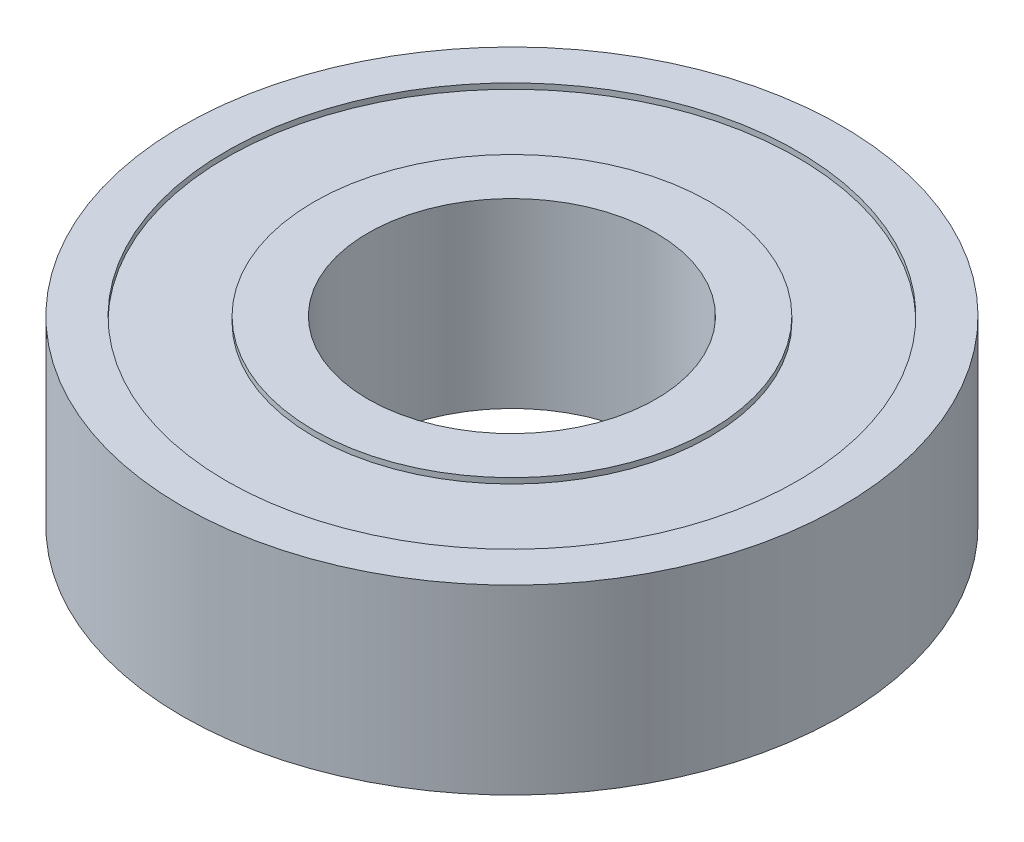
from build123d import *

# Parameters (mm, degrees)
ESBO_O1_R                = 14.32
RESSALTO_EXTRUS_O1_DEPTH = 7.9
ESBO_O2_R                = 6.255
CORTE_EXTRUS_O1_DEPTH    = 7.9
ESBO_O3_R                = 12.41
ESBO_O3_R_2              = 8.6
CORTE_EXTRUS_O2_DEPTH    = 0.24


with BuildPart() as part:
    # Esboço1 → Ressalto-extrusão1 (new body)
    with BuildSketch(Plane(origin=(0, 0, 0), x_dir=(1, 0, 0), z_dir=(0, 1, 0))):
        with Locations(Location((-2.489539578, 0, 0), (0, 0, 270))):
            Circle(ESBO_O1_R)
    extrude(amount=RESSALTO_EXTRUS_O1_DEPTH)

    # Esboço2 → Corte-extrusão1 (cut)
    with BuildSketch(Plane(origin=(0, 7.9, 0), x_dir=(1, 0, 0), z_dir=(0, 1, 0))):
        with Locations(Location((-2.489539578, 0, 0), (0, 0, 270))):
            Circle(ESBO_O2_R)
    extrude(amount=-CORTE_EXTRUS_O1_DEPTH, mode=Mode.SUBTRACT)

    # Esboço3 → Corte-extrusão2 (cut)
    with BuildSketch(Plane(origin=(0, 7.9, 0), x_dir=(1, 0, 0), z_dir=(0, 1, 0))):
        with Locations(Location((-2.489539578, 0, 0), (0, 0, 270))):
            Circle(ESBO_O3_R)
        with Locations(Location((-2.489539578, 0, 0), (0, 0, 270))):
            Circle(ESBO_O3_R_2, mode=Mode.SUBTRACT)
    corte_extrus_o2 = extrude(amount=-CORTE_EXTRUS_O2_DEPTH, mode=Mode.SUBTRACT)

    # Espelhar1: Corte-extrusão2 across plane
    add(corte_extrus_o2.mirror(Plane.ZX.offset(3.95)), mode=Mode.SUBTRACT)


solid = part.part
